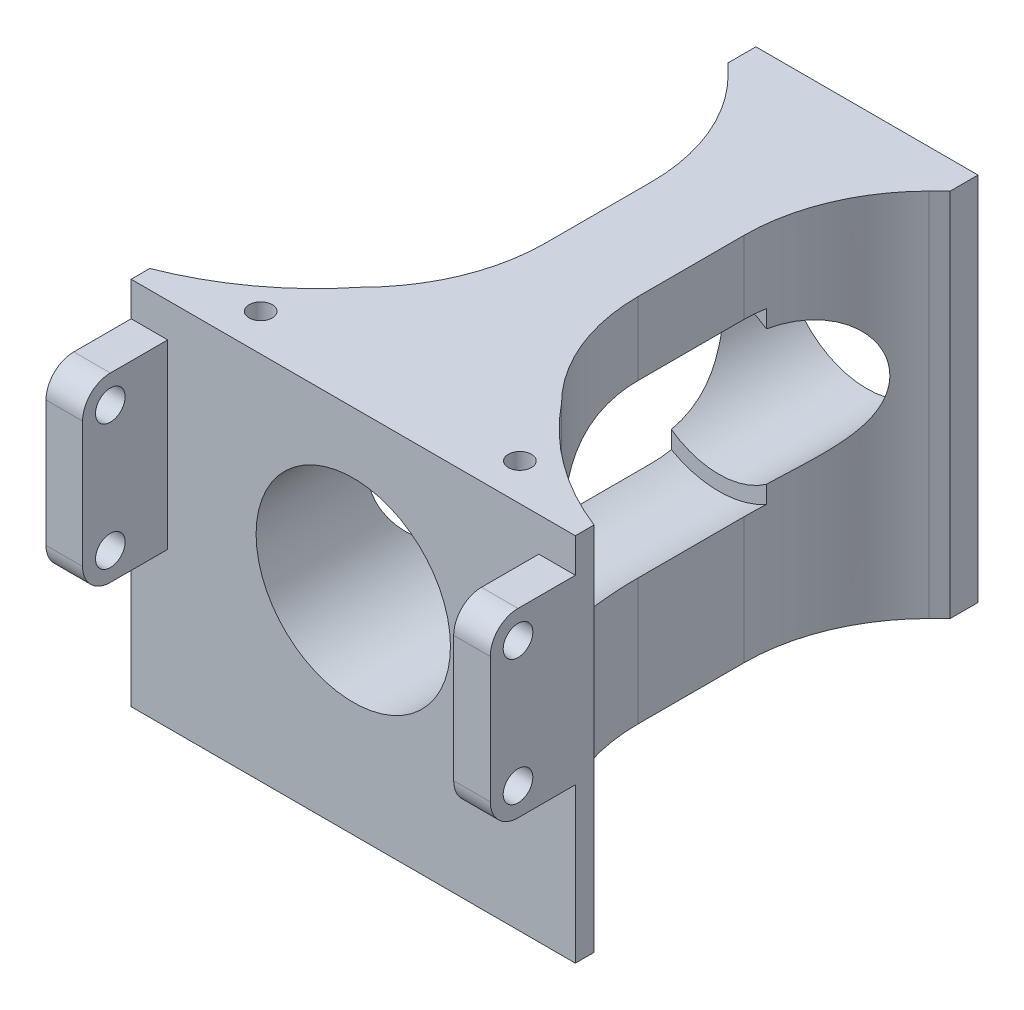
from build123d import *

# Parameters (mm, degrees)
SKETCH_1_W           = 48
SKETCH_1_H           = 31
SKETCH_1_R           = 8.9
EXTRUDE_1_DEPTH      = 65
SKETCH_2_R           = 10.5
CUT_EXTRUDE_1_DEPTH  = 49
CUT_EXTRUDE_3_DEPTH  = 76.907838857
EXTRUDE_4_DEPTH      = 8
SKETCH_11_R          = 1.25
CUT_EXTRUDE_9_DEPTH  = 80.511005658
SKETCH_15_W          = 40.1
SKETCH_15_H          = 9.5
CUT_EXTRUDE_11_DEPTH = 80.511005658
SKETCH_17_R          = 1.6
CUT_EXTRUDE_13_DEPTH = 85.150163426
SKETCH_19_W          = 3
SKETCH_19_H          = 3
CUT_EXTRUDE_14_DEPTH = 76.651107105
EXTRUDE_5_DEPTH      = 8
EXTRUDE_START        = 1
EXTRUDE_6_DEPTH      = 1
CUT_EXTRUDE_START    = -10
SKETCH_22_R          = 1.25
CUT_EXTRUDE_15_DEPTH = 10
SKETCH_23_R          = 1.25
CUT_EXTRUDE_16_DEPTH = 7


with BuildPart() as part:
    # 草图1 → 凸台-拉伸1 (new body)
    with BuildSketch(Plane.XY):
        Rectangle(SKETCH_1_W, SKETCH_1_H)
        with Locations((0, -0.6)):
            Circle(SKETCH_1_R, mode=Mode.SUBTRACT)
    extrude(amount=EXTRUDE_1_DEPTH)

    # 草图2 → 切除-拉伸1 (cut)
    with BuildSketch(Plane.XY.offset(65)):
        with Locations((0, -0.6)):
            Circle(SKETCH_2_R)
    extrude(amount=-CUT_EXTRUDE_1_DEPTH, mode=Mode.SUBTRACT)

    # 草图4 → 切除-拉伸3 (cut, through all)
    with BuildSketch(Plane(origin=(0, 15.5, 0), x_dir=(1, 0, 0), z_dir=(0, 1, 0))):
        with BuildLine():
            Line((-24, 9), (-10.857864376, -4.142135624))
            ThreePointArc((-10.857864376, -4.142135624), (-6.52240935, -10.6306026), (-5, -18.284271247))
            Line((-5, -18.284271247), (-5, -29.715728753))
            ThreePointArc((-5, -29.715728753), (-6.52240935, -37.3693974), (-10.857864376, -43.857864376))
            ThreePointArc((-10.857864376, -43.857864376), (-16.798925034, -49.531146093), (-24, -53.484226727))
            Line((-24, -53.484226727), (-24, 9))
        make_face()
        with BuildLine():
            Line((5, -18.284271247), (5, -29.715728753))
            ThreePointArc((5, -29.715728753), (6.52240935, -37.3693974), (10.857864376, -43.857864376))
            ThreePointArc((10.857864376, -43.857864376), (16.798925034, -49.531146093), (24, -53.484226727))
            Line((24, -53.484226727), (24, 9))
            Line((24, 9), (10.857864376, -4.142135624))
            ThreePointArc((10.857864376, -4.142135624), (6.52240935, -10.6306026), (5, -18.284271247))
        make_face()
    extrude(amount=-CUT_EXTRUDE_3_DEPTH, mode=Mode.SUBTRACT)

    # 草图12 → 凸台-拉伸4 (add)
    with BuildSketch(Plane.XZ.offset(15.5)):
        with BuildLine():
            Line((-5, 18.284271247), (5, 18.284271247))
            Line((5, 18.284271247), (5, 29.715728753))
            ThreePointArc((5, 29.715728753), (6.52240935, 37.3693974), (10.857864376, 43.857864376))
            ThreePointArc((10.857864376, 43.857864376), (16.798925034, 49.531146093), (24, 53.484226727))
            Line((24, 53.484226727), (24, 65))
            Line((24, 65), (-24, 65))
            Line((-24, 65), (-24, 53.484226727))
            ThreePointArc((-24, 53.484226727), (-16.798925034, 49.531146093), (-10.857864376, 43.857864376))
            ThreePointArc((-10.857864376, 43.857864376), (-6.52240935, 37.3693974), (-5, 29.715728753))
            Line((-5, 29.715728753), (-5, 18.284271247))
        make_face()
    extrude(amount=EXTRUDE_4_DEPTH)

    # 草图11 → 切除-拉伸9 (cut, through all)
    with BuildSketch(Plane(origin=(0, 15.5, 0), x_dir=(1, 0, 0), z_dir=(0, 1, 0))):
        with Locations(Location((14, -51.5, 0), (0, 0, 270))):
            Circle(SKETCH_11_R)
        with Locations(Location((-14, -51.5, 0), (0, 0, 270))):
            Circle(SKETCH_11_R)
    extrude(amount=-CUT_EXTRUDE_9_DEPTH, mode=Mode.SUBTRACT)

    # 草图15 → 切除-拉伸11 (cut, through all)
    with BuildSketch(Plane(origin=(0, 15.5, 0), x_dir=(1, 0, 0), z_dir=(0, 1, 0))):
        with Locations((0, -60.25)):
            Rectangle(SKETCH_15_W, SKETCH_15_H)
    extrude(amount=-CUT_EXTRUDE_11_DEPTH, mode=Mode.SUBTRACT)

    # 草图17 → 切除-拉伸13 (cut, through all)
    with BuildSketch(Plane(origin=(24, 0, 0), x_dir=(0, 0, -1), z_dir=(1, 0, 0))):
        with Locations((-61.7, 9.8)):
            Circle(SKETCH_17_R)
        with Locations((-61.7, -3.8)):
            Circle(SKETCH_17_R)
        with BuildLine():
            Line((-55.5, -23.5), (-55.5, -6.8))
            Line((-55.5, -6.8), (-61.7, -6.8))
            ThreePointArc((-61.7, -6.8), (-63.821320344, -5.921320344), (-64.7, -3.8))
            Line((-64.7, -3.8), (-64.7, 9.8))
            ThreePointArc((-64.7, 9.8), (-63.821320344, 11.921320344), (-61.7, 12.8))
            Line((-61.7, 12.8), (-55.5, 12.8))
            Line((-55.5, 12.8), (-55.5, 15.5))
            Line((-55.5, 15.5), (-64.7, 15.5))
            Line((-64.7, 15.5), (-94.5, 15.5))
            Line((-94.5, 15.5), (-94.5, -23.5))
            Line((-94.5, -23.5), (-55.5, -23.5))
        make_face()
    extrude(amount=-CUT_EXTRUDE_13_DEPTH, mode=Mode.SUBTRACT)

    # 草图19 → 切除-拉伸14 (cut, through all)
    with BuildSketch(Plane.XZ.offset(15.5)):
        with Locations((-13.5, 1.5)):
            Rectangle(SKETCH_19_W, SKETCH_19_H)
        with Locations((13.5, 1.5)):
            Rectangle(SKETCH_19_W, SKETCH_19_H)
    extrude(amount=-CUT_EXTRUDE_14_DEPTH, mode=Mode.SUBTRACT)

    # 草图20 → 凸台-拉伸5 (add)
    with BuildSketch(Plane.XZ.offset(15.5)):
        with BuildLine():
            Line((-10.857864376, 4.142135624), (-12, 3))
            Line((-12, 3), (-12, 0))
            Line((-12, 0), (12, 0))
            Line((12, 0), (12, 3))
            Line((12, 3), (10.857864376, 4.142135624))
            ThreePointArc((10.857864376, 4.142135624), (6.52240935, 10.6306026), (5, 18.284271247))
            Line((5, 18.284271247), (-5, 18.284271247))
            ThreePointArc((-5, 18.284271247), (-6.52240935, 10.6306026), (-10.857864376, 4.142135624))
        make_face()
    extrude(amount=EXTRUDE_5_DEPTH)

    # 草图21 → 凸台-拉伸6 (add)
    with BuildSketch(Plane(origin=(0, 15.5, 0), x_dir=(1, 0, 0), z_dir=(0, 1, 0)).offset(EXTRUDE_START)):
        with BuildLine():
            Line((12, 0), (-12, 0))
            Line((-12, 0), (-12, -3))
            Line((-12, -3), (-10.857864376, -4.142135624))
            ThreePointArc((-10.857864376, -4.142135624), (-6.52240935, -10.6306026), (-5, -18.284271247))
            Line((-5, -18.284271247), (-5, -29.715728753))
            ThreePointArc((-5, -29.715728753), (-6.52240935, -37.3693974), (-10.857864376, -43.857864376))
            ThreePointArc((-10.857864376, -43.857864376), (-16.798925034, -49.531146093), (-24, -53.484226727))
            Line((-24, -53.484226727), (-24, -55.5))
            Line((-24, -55.5), (24, -55.5))
            Line((24, -55.5), (24, -53.484226727))
            ThreePointArc((24, -53.484226727), (16.798925034, -49.531146093), (10.857864376, -43.857864376))
            ThreePointArc((10.857864376, -43.857864376), (6.52240935, -37.3693974), (5, -29.715728753))
            Line((5, -29.715728753), (5, -18.284271247))
            ThreePointArc((5, -18.284271247), (6.52240935, -10.6306026), (10.857864376, -4.142135624))
            Line((10.857864376, -4.142135624), (12, -3))
            Line((12, -3), (12, 0))
        make_face()
    extrude(amount=-EXTRUDE_6_DEPTH)

    # 草图22 → 切除-拉伸15 (cut)
    with BuildSketch(Plane.XZ.offset(-15.5).offset(CUT_EXTRUDE_START)):
        with Locations(Location((-14, 51.5, 0), (0, 0, 90))):
            Circle(SKETCH_22_R)
        with Locations(Location((14, 51.5, 0), (0, 0, 90))):
            Circle(SKETCH_22_R)
    extrude(amount=CUT_EXTRUDE_15_DEPTH, mode=Mode.SUBTRACT)

    # 草图23 → 切除-拉伸16 (cut)
    with BuildSketch(Plane.XZ.offset(23.5)):
        with Locations(Location((0, 6, 0), (0, 0, 270))):
            Circle(SKETCH_23_R)
    extrude(amount=-CUT_EXTRUDE_16_DEPTH, mode=Mode.SUBTRACT)


solid = part.part
